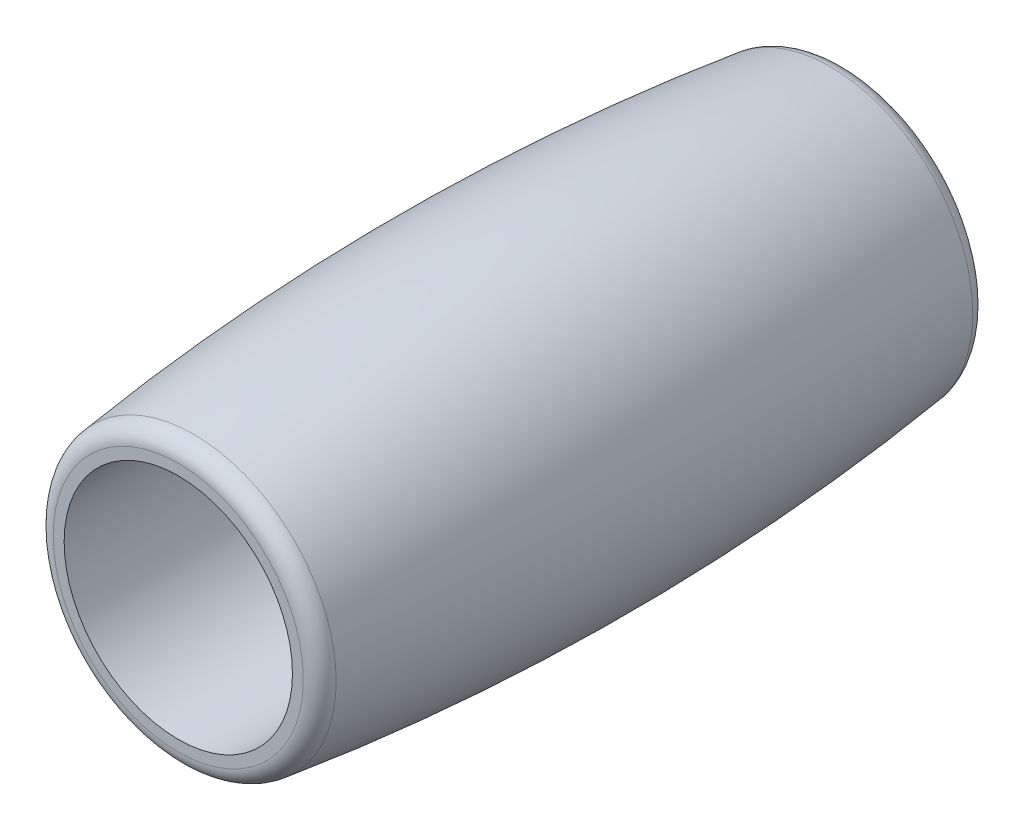
from build123d import *

# Parameters (mm, degrees)
FILLET_1_R = 1
FILLET_2_R = 1


with BuildPart() as part:
    # 草图1 → 旋转1 (revolve)
    with BuildSketch(Plane(origin=(0, 0, 0), x_dir=(1, 0, 0), z_dir=(0, 1, 0)), mode=Mode.PRIVATE) as revolve_1_sk:
        with BuildLine():
            Line((8, 19.597114905), (6.5, 19.597114905))
            Line((6.5, 19.597114905), (6.5, -18.402885095))
            Line((6.5, -18.402885095), (8, -18.402885095))
            ThreePointArc((8, -18.402885095), (9.25, 0.597114905), (8, 19.597114905))
        make_face()
    revolve(revolve_1_sk.sketch.rotate(Axis((0, 0, -17.560419169), (0, 0, 1)), 180), axis=Axis((0, 0, -17.560419169), (0, 0, 1)))

    # 圆角1
    fillet_1_edges = [part.edges().sort_by_distance(p)[0] for p in [
        (8, 0, 18.402885095),
    ]]
    fillet(fillet_1_edges, radius=FILLET_1_R)

    # 圆角2
    fillet_2_edges = [part.edges().sort_by_distance(p)[0] for p in [
        (8, 0, -19.597114905),
    ]]
    fillet(fillet_2_edges, radius=FILLET_2_R)


solid = part.part
